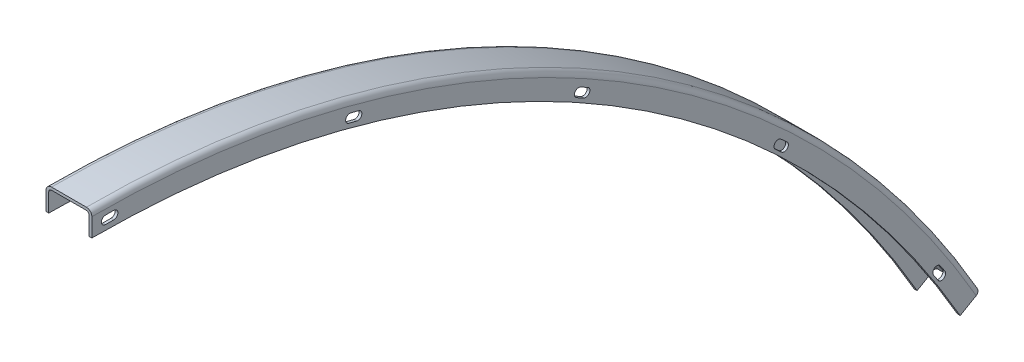
from build123d import *

# Parameters (mm, degrees)
REVOLVE1_ANGLE     = 60
CUT_EXTRUDE1_DEPTH = 10


with BuildPart() as part:
    # Sketch1 → Revolve1 (revolve)
    with BuildSketch(Plane.XY):
        with BuildLine():
            ThreePointArc((-52.157480315, 97.330708661), (-49.814334564, 102.987562911), (-44.157480315, 105.330708661))
            Line((-44.157480315, 105.330708661), (6.842519685, 105.330708661))
            ThreePointArc((6.842519685, 105.330708661), (12.499373935, 102.987562911), (14.842519685, 97.330708661))
            Line((14.842519685, 97.330708661), (14.842519685, 70.330708661))
            Line((14.842519685, 70.330708661), (10.842519685, 70.330708661))
            Line((10.842519685, 70.330708661), (10.842519685, 97.330708661))
            ThreePointArc((10.842519685, 97.330708661), (9.67094681, 100.159135786), (6.842519685, 101.330708661))
            Line((6.842519685, 101.330708661), (-44.157480315, 101.330708661))
            ThreePointArc((-44.157480315, 101.330708661), (-46.98590744, 100.159135786), (-48.157480315, 97.330708661))
            Line((-48.157480315, 97.330708661), (-48.157480315, 70.330708661))
            Line((-48.157480315, 70.330708661), (-52.157480315, 70.330708661))
            Line((-52.157480315, 70.330708661), (-52.157480315, 97.330708661))
        make_face()
    revolve(axis=Axis((14.842519685, -1394.669291339, 0), (-1, 0, 0)), revolution_arc=REVOLVE1_ANGLE)

    # Sketch2 → Cut-Extrude1 (cut)
    with BuildSketch(Plane(origin=(14.842519685, 0, 0), x_dir=(0, 0, -1), z_dir=(1, 0, 0))):
        with BuildLine():
            Line((20, 89.330708661), (32, 89.330708661))
            ThreePointArc((32, 89.330708661), (38, 83.330708661), (32, 77.330708661))
            Line((32, 77.330708661), (20, 77.330708661))
            ThreePointArc((20, 77.330708661), (14, 83.330708661), (20, 89.330708661))
        make_face()
        with BuildLine():
            Line((378.289058205, 39.427219846), (389.93260692, 36.524157099))
            ThreePointArc((389.93260692, 36.524157099), (394.302849904, 29.250851367), (387.029544173, 24.880608383))
            Line((387.029544173, 24.880608383), (375.385995457, 27.783671131))
            ThreePointArc((375.385995457, 27.783671131), (371.015752473, 35.056976862), (378.289058205, 39.427219846))
        make_face()
        with BuildLine():
            Line((713.862653541, -95.671890212), (724.458024655, -101.305548965))
            ThreePointArc((724.458024655, -101.305548965), (726.938880836, -109.420063899), (718.824365902, -111.900920079))
            Line((718.824365902, -111.900920079), (708.228994787, -106.267261326))
            ThreePointArc((708.228994787, -106.267261326), (705.748138607, -98.152746392), (713.862653541, -95.671890212))
        make_face()
        with BuildLine():
            Line((1006.784846148, -307.940579621), (1015.702584053, -315.970146897))
            ThreePointArc((1015.702584053, -315.970146897), (1016.146669368, -324.443799488), (1007.673016777, -324.887884803))
            Line((1007.673016777, -324.887884803), (998.755278871, -316.858317527))
            ThreePointArc((998.755278871, -316.858317527), (998.311193557, -308.384664936), (1006.784846148, -307.940579621))
        make_face()
        with BuildLine():
            Line((1239.653554047, -584.768273876), (1246.363868889, -594.716724747))
            ThreePointArc((1246.363868889, -594.716724747), (1244.744800874, -603.046107603), (1236.415418018, -601.427039588))
            Line((1236.415418018, -601.427039588), (1229.705103176, -591.478588718))
            ThreePointArc((1229.705103176, -591.478588718), (1231.324171191, -583.149205861), (1239.653554047, -584.768273876))
        make_face()
        with BuildLine():
            Line((1398.634385557, -909.709041767), (1402.738627277, -920.985353216))
            ThreePointArc((1402.738627277, -920.985353216), (1399.152592412, -928.675629801), (1391.462315827, -925.089594936))
            Line((1391.462315827, -925.089594936), (1387.358074107, -913.813283487))
            ThreePointArc((1387.358074107, -913.813283487), (1390.944108972, -906.123006902), (1398.634385557, -909.709041767))
        make_face()
    extrude(amount=-CUT_EXTRUDE1_DEPTH, mode=Mode.SUBTRACT)


solid = part.part
